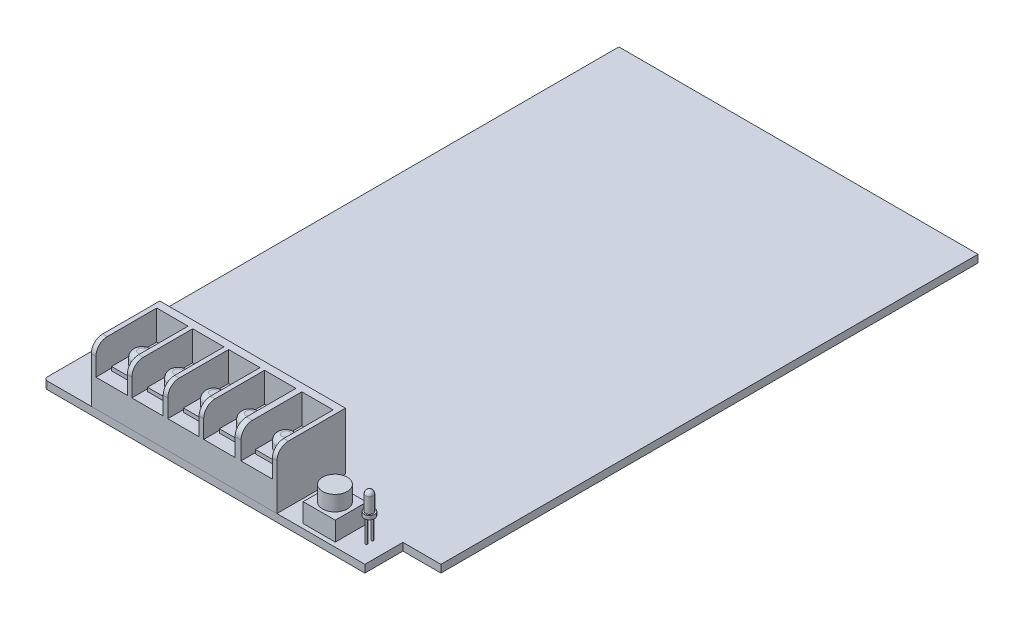
from build123d import *

# Parameters (mm, degrees)
SKETCH1_W          = 94.42
SKETCH1_H          = 151.2
EXTRUDE1_DEPTH     = 2
FILLET1_R          = 1
SKETCH2_W          = 48.8
SKETCH2_H          = 18
EXTRUDE2_DEPTH     = 15
SKETCH3_W          = 8.25
SKETCH3_H          = 7.75
EXTRUDE3_DEPTH     = 16
FILLET2_R          = 3
SKETCH4_W          = 7
SKETCH4_H          = 9
EXTRUDE4_DEPTH     = 1
SKETCH5_R          = 2.5
EXTRUDE5_DEPTH     = 3
FILLET3_R          = 1.5
LPATTERN1_COUNT    = 5
LPATTERN1_PITCH    = 9.45
SKETCH6_W          = 8.435696248
SKETCH6_H          = 8.247118126
EXTRUDE6_DEPTH     = 5
SKETCH7_R          = 3.25
EXTRUDE7_DEPTH     = 4
SKETCH8_W          = 10
SKETCH8_H          = 10
CUT_EXTRUDE1_DEPTH = 91.383317598
SKETCH9_R          = 0.25
EXTRUDE8_DEPTH     = 6
EXTRUDE8_2_DEPTH   = 6
SKETCH10_R         = 1.368864365
EXTRUDE9_DEPTH     = 1
SKETCH11_R         = 1
EXTRUDE10_DEPTH    = 4
DOME1_FACE_RADIUS  = 1
DOME1_HEIGHT       = 1


with BuildPart() as part:
    # Sketch1 → Extrude1 (new body)
    with BuildSketch(Plane(origin=(0, 0, 0), x_dir=(1, 0, 0), z_dir=(0, 1, 0))):
        Rectangle(SKETCH1_W, SKETCH1_H)
    extrude(amount=EXTRUDE1_DEPTH)

    # Fillet1
    fillet1_edges = [part.edges().sort_by_distance(p)[0] for p in [
        (-47.21, 1, 75.6),
    ]]
    fillet(fillet1_edges, radius=FILLET1_R)

    # Sketch8 → Cut-Extrude1 (cut, through all)
    with BuildSketch(Plane(origin=(0, 2, 0), x_dir=(1, 0, 0), z_dir=(0, 1, 0))):
        with Locations((42.21, -70.6)):
            Rectangle(SKETCH8_W, SKETCH8_H)
    extrude(amount=-CUT_EXTRUDE1_DEPTH, mode=Mode.SUBTRACT)


with BuildPart() as body_2:
    # Sketch2 → Extrude2 (new body)
    with BuildSketch(Plane(origin=(0, 2, 0), x_dir=(1, 0, 0), z_dir=(0, 1, 0))):
        with Locations((-10.31, -66.6)):
            Rectangle(SKETCH2_W, SKETCH2_H)
    extrude(amount=EXTRUDE2_DEPTH)

    # Sketch3 → Extrude3 (cut)
    with BuildSketch(Plane.XY.offset(75.6)):
        with Locations((-29.385, 13.125)):
            Rectangle(SKETCH3_W, SKETCH3_H)
        with Locations((-19.935, 13.125)):
            Rectangle(SKETCH3_W, SKETCH3_H)
        with Locations((-10.485, 13.125)):
            Rectangle(SKETCH3_W, SKETCH3_H)
        with Locations((-1.035, 13.125)):
            Rectangle(SKETCH3_W, SKETCH3_H)
        with Locations((8.765, 13.125)):
            Rectangle(SKETCH3_W, SKETCH3_H)
    extrude(amount=-EXTRUDE3_DEPTH, mode=Mode.SUBTRACT)

    # Fillet2
    fillet2_edges = [body_2.edges().sort_by_distance(p)[0] for p in [
        (-24.66, 17, 75.6),
        (-15.21, 17, 75.6),
        (-5.76, 17, 75.6),
        (3.865, 17, 75.6),
        (13.49, 17, 75.6),
        (-34.11, 17, 75.6),
    ]]
    fillet(fillet2_edges, radius=FILLET2_R)


with BuildPart() as body_3:
    # Sketch4 → Extrude4 (new body)
    with BuildSketch(Plane(origin=(0, 9.25, 0), x_dir=(1, 0, 0), z_dir=(0, 1, 0))):
        with Locations((-29.385, -67.6)):
            Rectangle(SKETCH4_W, SKETCH4_H)
    extrude(amount=EXTRUDE4_DEPTH)


with BuildPart() as body_4:
    # Sketch5 → Extrude5 (new body)
    with BuildSketch(Plane(origin=(0, 10.25, 0), x_dir=(1, 0, 0), z_dir=(0, 1, 0))):
        with Locations(Location((-29.385, -67.6, 0), (0, 0, 270))):
            Circle(SKETCH5_R)
    extrude(amount=EXTRUDE5_DEPTH)

    # Fillet3
    fillet3_edges = [body_4.edges().sort_by_distance(p)[0] for p in [
        (-29.385, 13.25, 65.1),
    ]]
    fillet(fillet3_edges, radius=FILLET3_R)


with BuildPart() as lpattern1_1:
    # LPattern1: pattern copy
    add(body_3.part.moved(Location(Vector(1, 0, 0) * (1 * LPATTERN1_PITCH))))


with BuildPart() as lpattern1_2:
    # LPattern1: pattern copy
    add(body_3.part.moved(Location(Vector(1, 0, 0) * (2 * LPATTERN1_PITCH))))


with BuildPart() as lpattern1_3:
    # LPattern1: pattern copy
    add(body_3.part.moved(Location(Vector(1, 0, 0) * (3 * LPATTERN1_PITCH))))


with BuildPart() as lpattern1_4:
    # LPattern1: pattern copy
    add(body_3.part.moved(Location(Vector(1, 0, 0) * (4 * LPATTERN1_PITCH))))


with BuildPart() as lpattern1_5:
    # LPattern1: pattern copy
    add(body_4.part.moved(Location(Vector(1, 0, 0) * (1 * LPATTERN1_PITCH))))


with BuildPart() as lpattern1_6:
    # LPattern1: pattern copy
    add(body_4.part.moved(Location(Vector(1, 0, 0) * (2 * LPATTERN1_PITCH))))


with BuildPart() as lpattern1_7:
    # LPattern1: pattern copy
    add(body_4.part.moved(Location(Vector(1, 0, 0) * (3 * LPATTERN1_PITCH))))


with BuildPart() as lpattern1_8:
    # LPattern1: pattern copy
    add(body_4.part.moved(Location(Vector(1, 0, 0) * (4 * LPATTERN1_PITCH))))


with BuildPart() as body_13:
    # Sketch6 → Extrude6 (new body)
    with BuildSketch(Plane(origin=(0, 2, 0), x_dir=(1, 0, 0), z_dir=(0, 1, 0))):
        with Locations((24.049805134, -70.312911815)):
            Rectangle(SKETCH6_W, SKETCH6_H)
    extrude(amount=EXTRUDE6_DEPTH)


with BuildPart() as body_14:
    # Sketch7 → Extrude7 (new body)
    with BuildSketch(Plane(origin=(0, 7, 0), x_dir=(1, 0, 0), z_dir=(0, 1, 0))):
        with Locations(Location((24.049805134, -70.312911815, 0), (0, 0, 270))):
            Circle(SKETCH7_R)
    extrude(amount=EXTRUDE7_DEPTH)


with BuildPart() as body_15:
    # Sketch9 → Extrude8 (new body)
    with BuildSketch(Plane(origin=(0, 2, 0), x_dir=(1, 0, 0), z_dir=(0, 1, 0))):
        with Locations(Location((32.730934271, -69.135346927, 0), (0, 0, 270))):
            Circle(SKETCH9_R)
    extrude(amount=EXTRUDE8_DEPTH)


with BuildPart() as body_16:
    # Sketch9 → Extrude8 2 (new body)
    with BuildSketch(Plane(origin=(0, 2, 0), x_dir=(1, 0, 0), z_dir=(0, 1, 0))):
        with Locations(Location((32.730934271, -70.712329275, 0), (0, 0, 270))):
            Circle(SKETCH9_R)
    extrude(amount=EXTRUDE8_2_DEPTH)


with BuildPart() as body_17:
    # Sketch10 → Extrude9 (new body)
    with BuildSketch(Plane(origin=(0, 8, 0), x_dir=(1, 0, 0), z_dir=(0, 1, 0))):
        with Locations(Location((32.730934271, -69.923838101, 0), (0, 0, 270))):
            Circle(SKETCH10_R)
    extrude(amount=EXTRUDE9_DEPTH)

    # Sketch11 → Extrude10 (add)
    with BuildSketch(Plane(origin=(0, 9, 0), x_dir=(1, 0, 0), z_dir=(0, 1, 0))):
        with Locations(Location((32.730934271, -69.923838101, 0), (0, 0, 270))):
            Circle(SKETCH11_R)
    extrude(amount=EXTRUDE10_DEPTH)

    # Dome1: a dome of height H over a round flat face of radius A is a cap of a sphere of radius (A * A + H * H) / (2 * H)
    dome1_r = (DOME1_FACE_RADIUS * DOME1_FACE_RADIUS + DOME1_HEIGHT * DOME1_HEIGHT) / (2 * DOME1_HEIGHT)
    dome1_base = Plane((32.730934271, 13, 69.923838101), z_dir=(0, 1, 0))
    with Locations(dome1_base.offset(DOME1_HEIGHT - dome1_r)):
        dome1_ball = Sphere(dome1_r, mode=Mode.PRIVATE)
    add(split(dome1_ball, bisect_by=dome1_base, keep=Keep.TOP, mode=Mode.PRIVATE))


solid = Compound([part.part, body_2.part, body_3.part, body_4.part, lpattern1_1.part, lpattern1_2.part, lpattern1_3.part, lpattern1_4.part, lpattern1_5.part, lpattern1_6.part, lpattern1_7.part, lpattern1_8.part, body_13.part, body_14.part, body_15.part, body_16.part, body_17.part])
